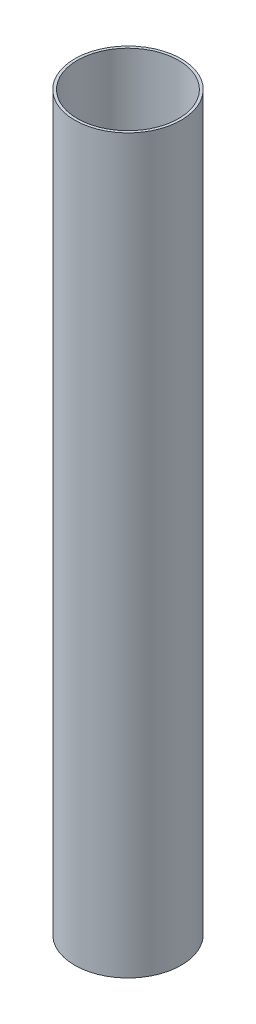
from build123d import *

# Parameters (mm, degrees)
SKETCH1_R           = 40
SKETCH1_R_2         = 38
BOSS_EXTRUDE1_DEPTH = 550


with BuildPart() as part:
    # Sketch1 → Boss-Extrude1 (new body)
    with BuildSketch(Plane(origin=(0, 0, 0), x_dir=(1, 0, 0), z_dir=(0, 1, 0))):
        with Locations(Location((0, 0, 0), (0, 0, 270))):
            Circle(SKETCH1_R)
        with Locations(Location((0, 0, 0), (0, 0, 270))):
            Circle(SKETCH1_R_2, mode=Mode.SUBTRACT)
    extrude(amount=BOSS_EXTRUDE1_DEPTH)


solid = part.part
